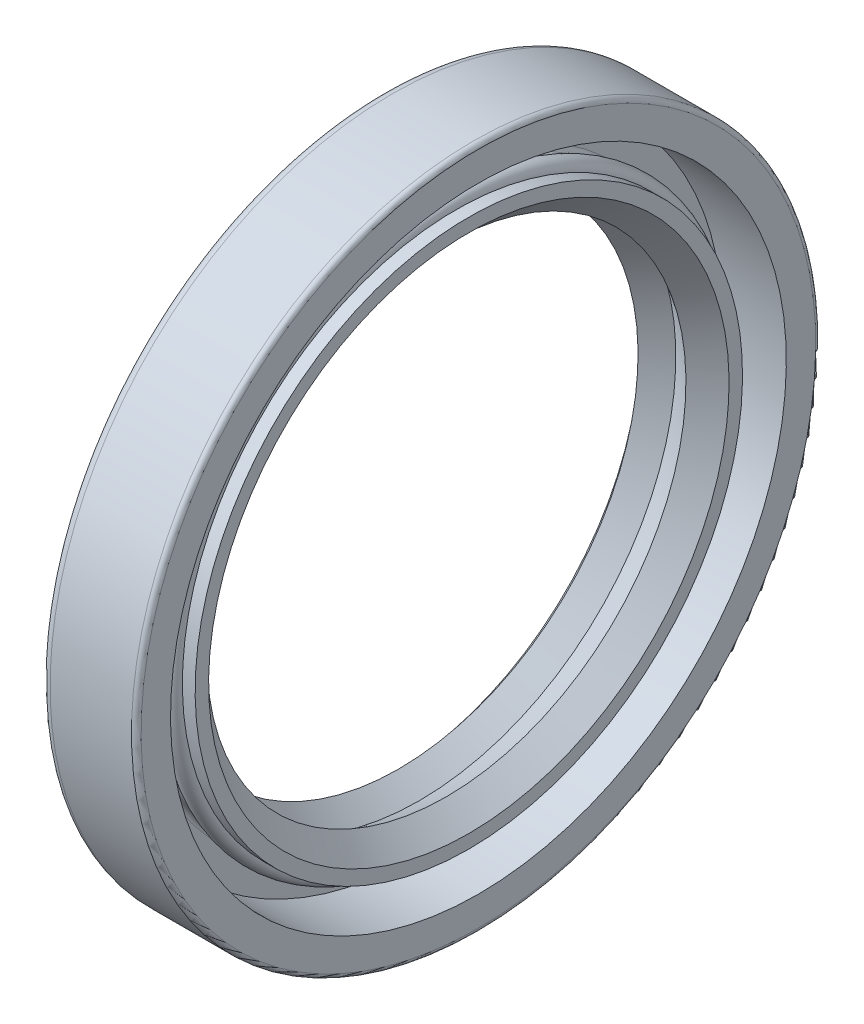
from build123d import *

# Parameters (mm, degrees)
SKETCH2_R = 0.7


with BuildPart() as part:
    # Sketch1 → Revolve1 (revolve)
    with BuildSketch(Plane.XY, mode=Mode.PRIVATE) as revolve1_sk:
        with BuildLine():
            Line((0, 22.5), (0.21875, 22.5))
            Line((0.21875, 22.5), (0.21875, 20))
            Line((0.21875, 20), (0, 20))
            Line((0, 20), (0, 19.375))
            Line((0, 19.375), (1.166666667, 18.75))
            Line((1.166666667, 18.75), (0.552716368, 18.242004405))
            Line((0.552716368, 18.242004405), (1.166666667, 17.5))
            Line((1.166666667, 17.5), (2.677384242, 18.75))
            Line((2.677384242, 18.75), (4.666666667, 17.5))
            Line((4.666666667, 17.5), (6.3, 19.016666667))
            Line((6.3, 19.016666667), (6.3, 20))
            Line((6.3, 20), (5.366666667, 20))
            ThreePointArc((5.366666667, 20), (4.666666667, 19.3), (3.966666667, 20))
            Line((3.966666667, 20), (2.683333333, 20))
            ThreePointArc((2.683333333, 20), (2.43584596, 20.102512627), (2.333333333, 20.35))
            Line((2.333333333, 20.35), (2.333333333, 22.5))
            Line((2.333333333, 22.5), (7, 22.5))
            Line((7, 22.5), (7, 24.65))
            ThreePointArc((7, 24.65), (6.897487373, 24.897487373), (6.65, 25))
            Line((6.65, 25), (0.7, 25))
            ThreePointArc((0.7, 25), (0.205025253, 24.794974747), (0, 24.3))
            Line((0, 24.3), (0, 22.5))
        make_face()
    revolve(revolve1_sk.sketch.rotate(Axis((7, 0, 0), (-1, 0, 0)), 180), axis=Axis((7, 0, 0), (-1, 0, 0)))


with BuildPart() as body_2:
    # Sketch2 → Revolve2 (revolve)
    with BuildSketch(Plane.XY, mode=Mode.PRIVATE) as revolve2_sk:
        with Locations((4.666666667, 20)):
            Circle(SKETCH2_R)
    revolve(revolve2_sk.sketch.rotate(Axis((0, 0, 0), (1, 0, 0)), 90), axis=Axis((0, 0, 0), (1, 0, 0)))


solid = Compound([part.part, body_2.part])
